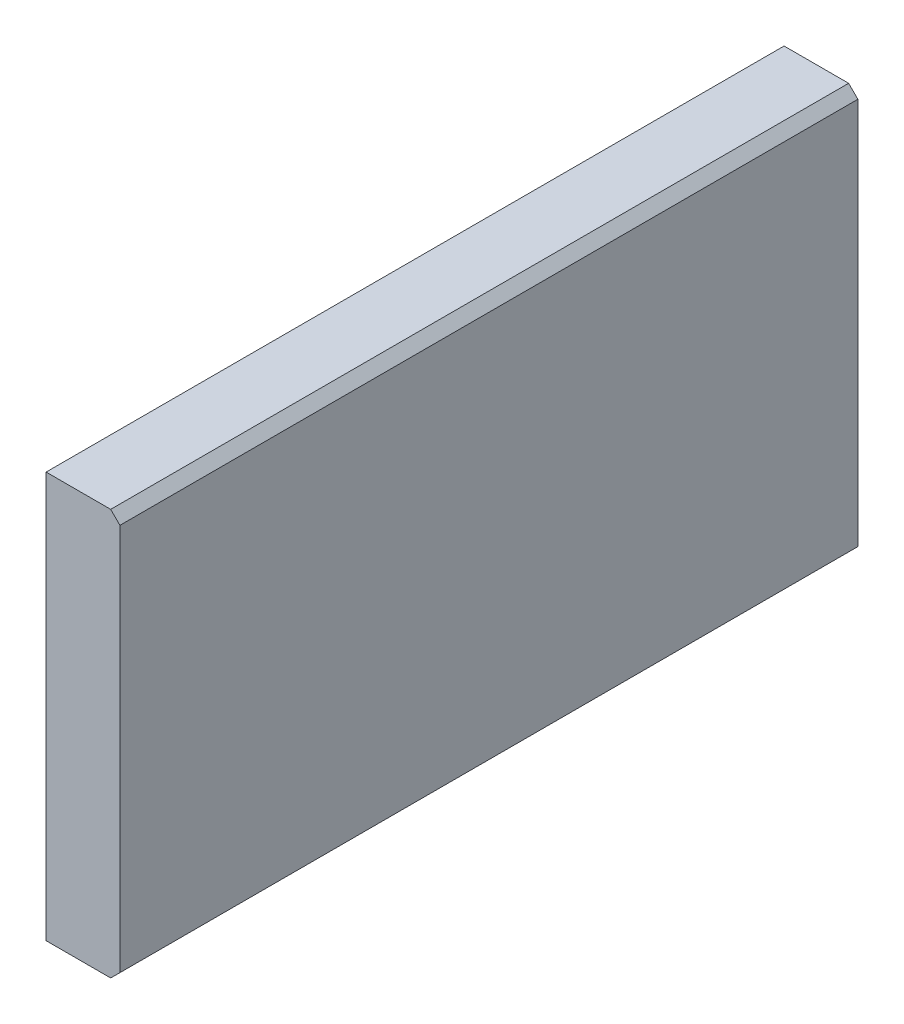
from build123d import *

# Parameters (mm, degrees)
SKETCH1_W           = 80
SKETCH1_H           = 44
BOSS_EXTRUDE1_DEPTH = 8
SKETCH2_R           = 1.5
BOSS_EXTRUDE2_DEPTH = 2.8
CHAMFER1_SIZE       = 1


with BuildPart() as part:
    # Sketch1 → Boss-Extrude1 (new body)
    with BuildSketch(Plane(origin=(24, 0, 0), x_dir=(0, 0, -1), z_dir=(1, 0, 0))):
        Rectangle(SKETCH1_W, SKETCH1_H)
    extrude(amount=BOSS_EXTRUDE1_DEPTH)

    # Sketch2 → Boss-Extrude2 (add)
    with BuildSketch(Plane(origin=(21.2, 0, 0), x_dir=(0, 0, -1), z_dir=(1, 0, 0))):
        with Locations((-4, -4)):
            Circle(SKETCH2_R)
        with Locations((4, -4)):
            Circle(SKETCH2_R)
        with Locations((-4, 4)):
            Circle(SKETCH2_R)
        with Locations((4, 4)):
            Circle(SKETCH2_R)
    extrude(amount=BOSS_EXTRUDE2_DEPTH)

    # Chamfer1
    chamfer1_edges = [part.edges().sort_by_distance(p)[0] for p in [
        (32, 22, 0),
        (32, -22, 0),
    ]]
    chamfer(chamfer1_edges, length=CHAMFER1_SIZE)


solid = part.part
